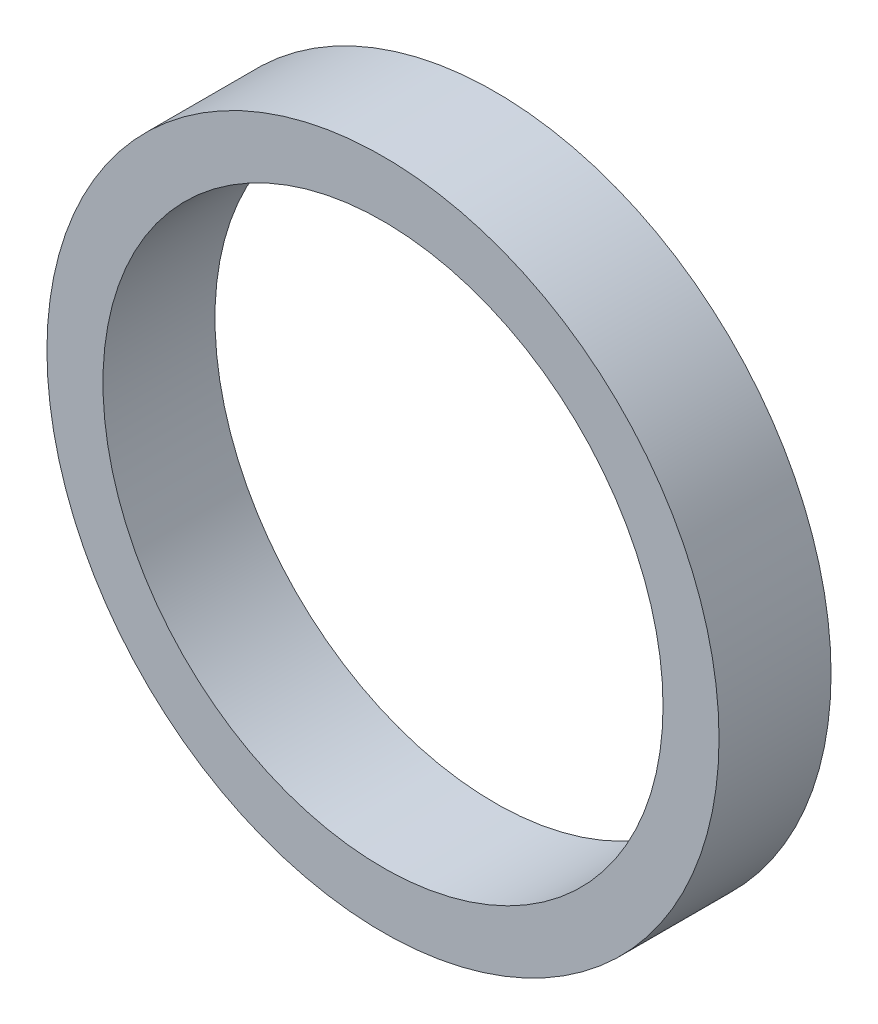
from build123d import *

# Parameters (mm, degrees)
SKETCH_1_R      = 24
SKETCH_1_R_2    = 20
EXTRUDE_1_DEPTH = 8


with BuildPart() as part:
    # Эскиз1 → Бобышка-Вытянуть1 (new body)
    with BuildSketch(Plane.XY):
        Circle(SKETCH_1_R)
        Circle(SKETCH_1_R_2, mode=Mode.SUBTRACT)
    extrude(amount=EXTRUDE_1_DEPTH)


solid = part.part
